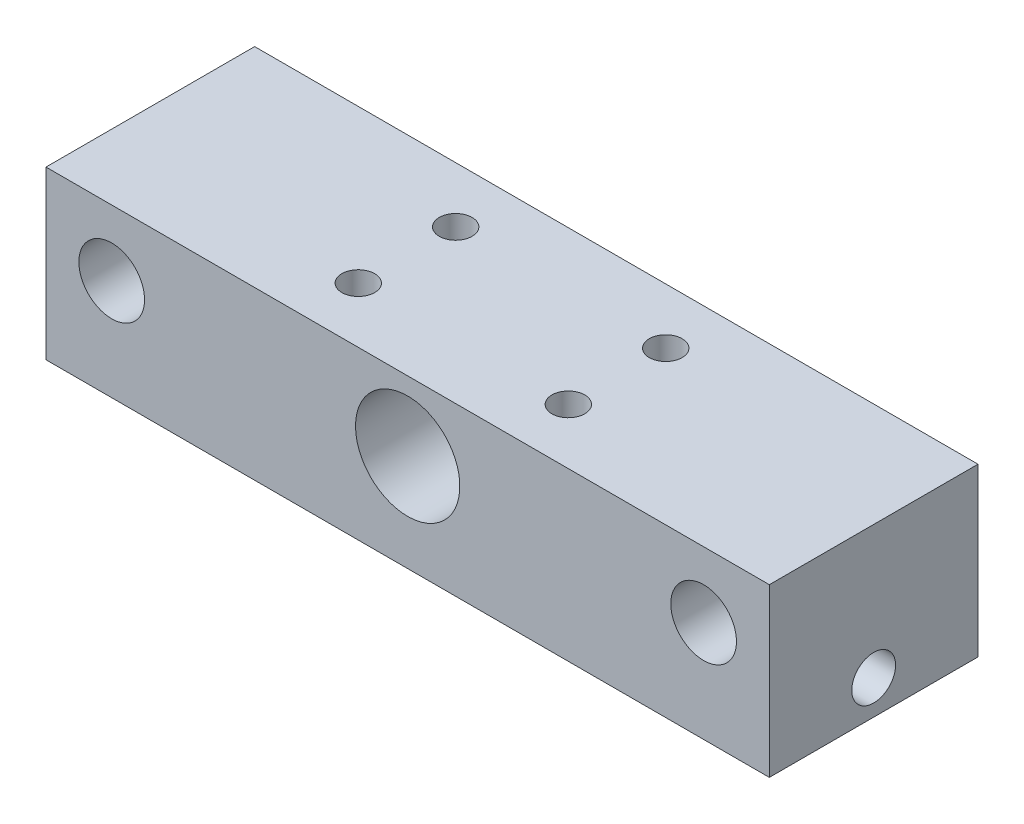
from build123d import *

# Parameters (mm, degrees)
SKETCH1_W           = 66.04
SKETCH1_H           = 15.24
SKETCH1_R           = 2.99974
SKETCH1_R_2         = 4.7625
BOSS_EXTRUDE1_DEPTH = 19.05
CUT_EXTRUDE2_DEPTH  = 19.05
CUT_EXTRUDE3_START  = -19.05
SKETCH3_R           = 2.00025
CUT_EXTRUDE3_DEPTH  = 19.05
SKETCH4_R           = 1.4986
CUT_EXTRUDE4_DEPTH  = 10.16


with BuildPart() as part:
    # Sketch1 → Boss-Extrude1 (new body)
    with BuildSketch(Plane.XY):
        with Locations((0, -1.27)):
            Rectangle(SKETCH1_W, SKETCH1_H)
        with Locations(Location((-27.02052, 0.35052, 0), (0, 0, 180))):
            Circle(SKETCH1_R, mode=Mode.SUBTRACT)
        with Locations(Location((0, 0, 0), (0, 0, 180))):
            Circle(SKETCH1_R_2, mode=Mode.SUBTRACT)
        with Locations(Location((27.02052, 0.35052, 0), (0, 0, 180))):
            Circle(SKETCH1_R, mode=Mode.SUBTRACT)
    extrude(amount=BOSS_EXTRUDE1_DEPTH)

    # Sketch2 → Cut-Extrude2 (cut)
    with BuildSketch(Plane.ZY.offset(33.02)):
        with BuildLine():
            ThreePointArc((11.52525, -5.76961), (9.525, -3.76936), (7.52475, -5.76961))
            Line((7.52475, -5.76961), (11.52525, -5.76961))
        make_face()
        with BuildLine():
            Line((11.52525, -5.76961), (7.52475, -5.76961))
            ThreePointArc((7.52475, -5.76961), (9.525, -7.76986), (11.52525, -5.76961))
        make_face()
    extrude(amount=-CUT_EXTRUDE2_DEPTH, mode=Mode.SUBTRACT)

    # Sketch3 → Cut-Extrude3 (cut)
    with BuildSketch(Plane(origin=(33.02, 0, 0), x_dir=(0, 0, -1), z_dir=(1, 0, 0)).offset(CUT_EXTRUDE3_START)):
        with Locations(Location((-9.525, -5.76961, 0), (0, 0, 180))):
            Circle(SKETCH3_R)
    extrude(amount=CUT_EXTRUDE3_DEPTH, mode=Mode.SUBTRACT)

    # Sketch4 → Cut-Extrude4 (cut)
    with BuildSketch(Plane(origin=(0, 6.35, 0), x_dir=(1, 0, 0), z_dir=(0, 1, 0))):
        with Locations(Location((9.5885, -5.08, 0), (0, 0, 270))):
            Circle(SKETCH4_R)
        with Locations(Location((9.5885, -13.97, 0), (0, 0, 270))):
            Circle(SKETCH4_R)
        with Locations(Location((-9.5885, -5.08, 0), (0, 0, 270))):
            Circle(SKETCH4_R)
        with Locations(Location((-9.5885, -13.97, 0), (0, 0, 270))):
            Circle(SKETCH4_R)
    extrude(amount=-CUT_EXTRUDE4_DEPTH, mode=Mode.SUBTRACT)


solid = part.part
